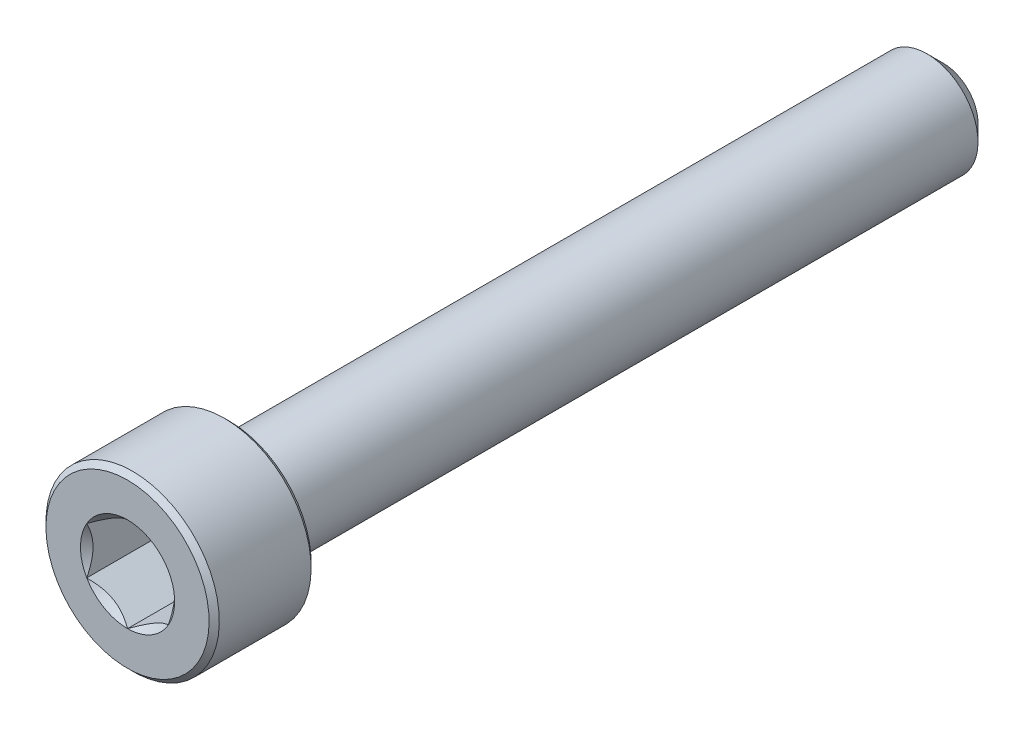
from build123d import *

# Parameters (mm, degrees)
CUT_EXTRUDE1_DEPTH = 4


with BuildPart() as part:
    # Sketch2 → Revolve1 (revolve)
    with BuildSketch(Plane(origin=(0, 0, 0), x_dir=(0, 0, -1), z_dir=(1, 0, 0))):
        Polygon((-20, 0), (-20, 4), (-19.75, 4.25), (-15.25, 4.25), (-15, 4), (-15, 2.5), (19.2, 2.5), (20, 1.7), (20, 0), align=None)
    revolve(axis=Axis((0, 0, -20), (0, 0, 1)))

    # Sketch3 → Cut-Extrude1 (cut)
    with BuildSketch(Plane.XY.offset(20)):
        Polygon((2, -1.154700538), (2, 1.154700538), (0, 2.309401077), (-2, 1.154700538), (-2, -1.154700538), (0, -2.309401077), align=None)
    extrude(amount=-CUT_EXTRUDE1_DEPTH, mode=Mode.SUBTRACT)

    # Cut-Extrude2 cone 1 section (through the dimple's axis) → Cut-Extrude2 (revolve, cut)
    with BuildSketch(Plane(origin=(0, 0, 20), x_dir=(0, -1, 0), z_dir=(1, 0, 0))):
        Polygon((0, 0), (2.309401077, 0), (0, 2.309401077), align=None)
    revolve(axis=Axis((0, 0, 20), (0, 0, -1)), mode=Mode.SUBTRACT)


solid = part.part
